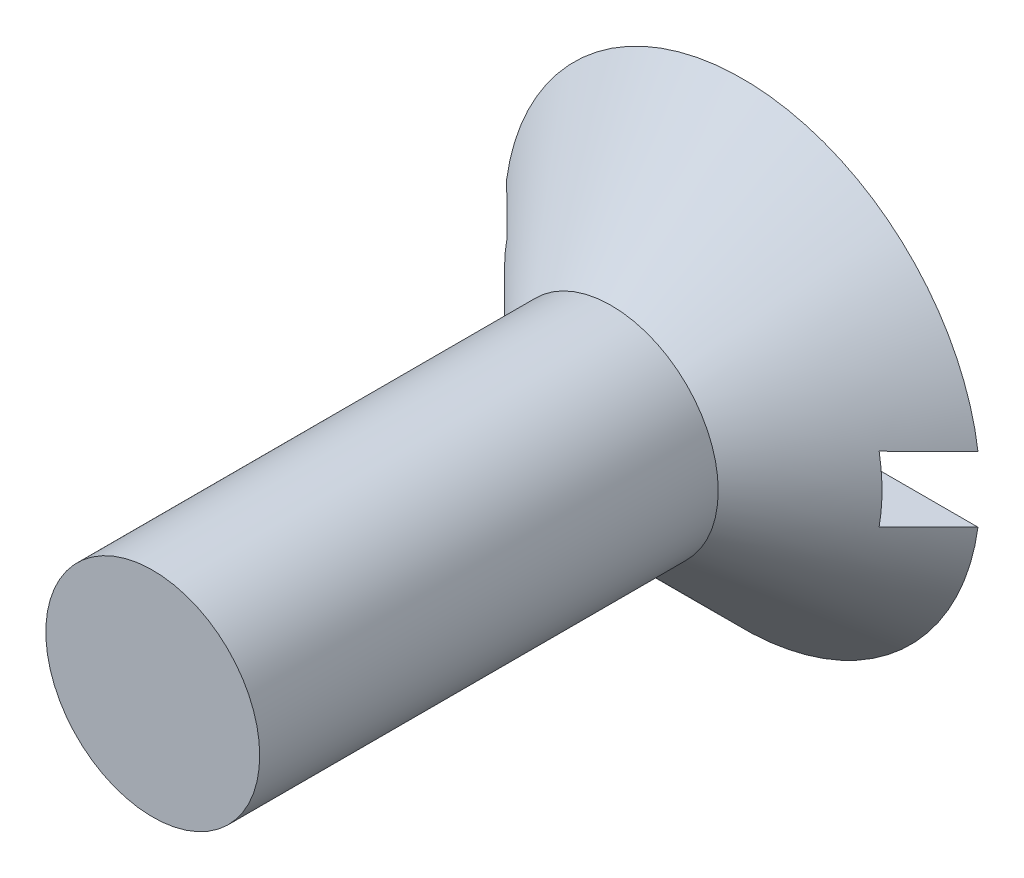
from build123d import *

# Parameters (mm, degrees)
ESBO_O2_W             = 15
ESBO_O2_H             = 2
CORTE_EXTRUS_O1_DEPTH = 1.5


with BuildPart() as part:
    # Esboço1 → Revolução1 (revolve)
    with BuildSketch(Plane(origin=(0, 0, 0), x_dir=(0, 0, -1), z_dir=(1, 0, 0)), mode=Mode.PRIVATE) as revolu_o1_sk:
        Polygon((0, 0), (0, 7.265), (-4, 3.265), (-18, 3.265), (-18, 0), align=None)
    revolve(revolu_o1_sk.sketch.rotate(Axis((0, 0, 18), (0, 0, -1)), 90), axis=Axis((0, 0, 18), (0, 0, -1)))

    # Esboço2 → Corte-extrusão1 (cut)
    with BuildSketch(Plane(origin=(0, 0, 0), x_dir=(-1, 0, 0), z_dir=(0, 0, -1))):
        Rectangle(ESBO_O2_W, ESBO_O2_H)
    extrude(amount=-CORTE_EXTRUS_O1_DEPTH, mode=Mode.SUBTRACT)


solid = part.part
